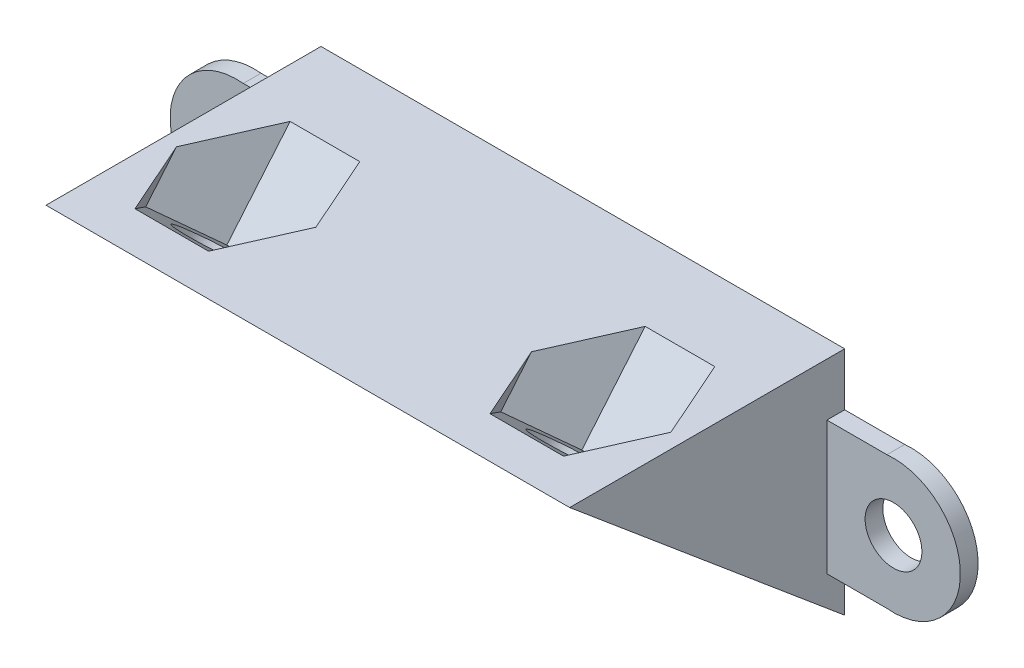
from build123d import *

# Parameters (mm, degrees)
SKETCH1_R           = 1.6
BOSS_EXTRUDE1_DEPTH = 1
BOSS_EXTRUDE2_DEPTH = 15.492796704
SKETCH2_R           = 2
CUT_EXTRUDE2_DEPTH  = 43.166654476
CUT_EXTRUDE3_START  = -1.5
SKETCH2_3_R         = 2
CUT_EXTRUDE3_DEPTH  = 41.666654476
SKETCH3_W           = 29.5
SKETCH3_H           = 22.485495194
CUT_EXTRUDE4_DEPTH  = 43.166654476


with BuildPart() as part:
    # Sketch1 → Boss-Extrude1 (new body)
    # profile 1 of 3: a face of its own
    with BuildSketch(Plane.XY):
        Polygon((-29.5, 10.023123532), (-29.5, 13), (0, 13), (0, 10.023123532), (0, 2.523123532), (0, 0), (-29.5, 0), (-29.5, 2.523123532), align=None)
    # profile 2 of 3: a face of its own
    with BuildSketch(Plane.XY):
        with BuildLine():
            ThreePointArc((3.38, 10.023123532), (7.518209124, 6.273123532), (3.38, 2.523123532))
            Line((3.38, 2.523123532), (0, 2.523123532))
            Line((0, 2.523123532), (0, 10.023123532))
            Line((0, 10.023123532), (3.38, 10.023123532))
        make_face()
        with Locations((3.75, 6.273123532)):
            Circle(SKETCH1_R, mode=Mode.SUBTRACT)
    # profile 3 of 3: a face of its own
    with BuildSketch(Plane.XY):
        with BuildLine():
            ThreePointArc((-32.88, 2.541421507), (-37, 6.273123532), (-32.88, 10.004825556))
            Line((-32.88, 10.004825556), (-29.5, 10.023123532))
            Line((-29.5, 10.023123532), (-29.5, 2.523123532))
            Line((-29.5, 2.523123532), (-32.88, 2.541421507))
        make_face()
        with Locations((-33.25, 6.273123532)):
            Circle(SKETCH1_R, mode=Mode.SUBTRACT)
    extrude(amount=BOSS_EXTRUDE1_DEPTH)

    # Sketch1<4> → Boss-Extrude2 (add)
    with BuildSketch(Plane.XY):
        Polygon((-29.5, 10.023123532), (-29.5, 13), (0, 13), (0, 10.023123532), (0, 2.523123532), (0, 0), (-29.5, 0), (-29.5, 2.523123532), align=None)
    extrude(amount=BOSS_EXTRUDE2_DEPTH)

    # Sketch2 → Cut-Extrude2 (cut, through all)
    with BuildSketch(Plane(origin=(0, 0, 0), x_dir=(1, 0, 0), z_dir=(0, -0.7660444431189791, 0.642787609686538))):
        with Locations(Location((-4.75, 15.224409749, 0), (0, 0, 270))):
            Circle(SKETCH2_R)
        with Locations(Location((-24.75, 15.224409749, 0), (0, 0, 270))):
            Circle(SKETCH2_R)
    extrude(amount=-CUT_EXTRUDE2_DEPTH, mode=Mode.SUBTRACT)

    # Sketch2<3> → Cut-Extrude3 (cut, through all)
    # profile 1 of 2: a face of its own
    with BuildSketch(Plane(origin=(0, 0, 0), x_dir=(1, 0, 0), z_dir=(0, -0.7660444431189791, 0.642787609686538)).offset(CUT_EXTRUDE3_START)):
        Polygon((-2.787009085, 11.824409749), (-0.82401817, 15.224409749), (-2.787009085, 18.624409749), (-6.712990915, 18.624409749), (-8.67598183, 15.224409749), (-6.712990915, 11.824409749), align=None)
        with Locations(Location((-4.75, 15.224409749, 0), (0, 0, 270))):
            Circle(SKETCH2_3_R, mode=Mode.SUBTRACT)
    # profile 2 of 2: a face of its own
    with BuildSketch(Plane(origin=(0, 0, 0), x_dir=(1, 0, 0), z_dir=(0, -0.7660444431189791, 0.642787609686538)).offset(CUT_EXTRUDE3_START)):
        Polygon((-20.82401817, 15.224409749), (-22.787009085, 18.624409749), (-26.712990915, 18.624409749), (-28.67598183, 15.224409749), (-26.712990915, 11.824409749), (-22.787009085, 11.824409749), align=None)
        with Locations(Location((-24.75, 15.224409749, 0), (0, 0, 270))):
            Circle(SKETCH2_3_R, mode=Mode.SUBTRACT)
    extrude(amount=-CUT_EXTRUDE3_DEPTH, mode=Mode.SUBTRACT)

    # Sketch3 → Cut-Extrude4 (cut, through all)
    with BuildSketch(Plane(origin=(0, 0, 0), x_dir=(1, 0, 0), z_dir=(0, -0.7660444431189791, 0.642787609686538))):
        with Locations((-14.75, 8.981662152)):
            Rectangle(SKETCH3_W, SKETCH3_H)
    extrude(amount=CUT_EXTRUDE4_DEPTH, mode=Mode.SUBTRACT)


solid = part.part
